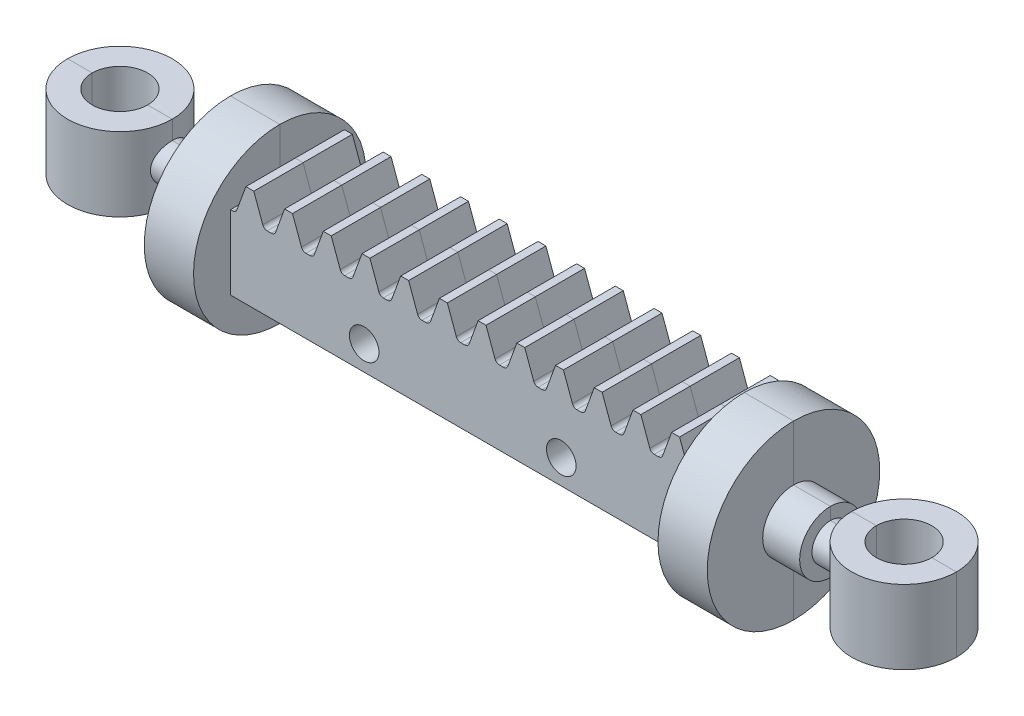
from build123d import *

# Parameters (mm, degrees)
SKETCH2_W                 = 37.699111843
SKETCH2_H                 = 6
BACK_DEPTH                = 8
TEETH_DEPTH               = 8
FILLET1_R                 = 0.38
LPATTERN1_COUNT           = 12
LPATTERN1_PITCH           = 3.141592654
FILLET1_OF_LPATTERN1_R    = 0.38
BOSS_EXTRUDE10_DEPTH      = 3
BOSS_EXTRUDE10_DEPTH_BACK = 3
SKETCH6_7_R               = 4.25
SKETCH6_7_R_2             = 2.25
SKETCH8_R                 = 2
SKETCH8_R_2               = 1.6
SKETCH8_R_3               = 1.2
BOSS_EXTRUDE11_DEPTH      = 8
SKETCH8_3_R               = 1.2
CUT_EXTRUDE1_DEPTH        = 57.901863991


with BuildPart() as part:
    # Sketch2 → Back (new body)
    with BuildSketch(Plane.XY):
        with Locations((18.849555922, -3)):
            Rectangle(SKETCH2_W, SKETCH2_H)
    extrude(amount=-BACK_DEPTH)

    # Sketch2<3> → Teeth (add)
    with BuildSketch(Plane.XY):
        Polygon((1.249368398, 2.25), (0.430435371, 0), (2.711157283, 0), (1.892224256, 2.25), align=None)
    teeth = extrude(amount=-TEETH_DEPTH)

    # Fillet1
    fillet1_edges = [part.edges().sort_by_distance(p)[0] for p in [
        (2.711157283, 0, -4),
        (0.430435371, 0, -4),
    ]]
    fillet(fillet1_edges, radius=FILLET1_R)

    # LPattern1: Teeth ×12
    with Locations(*[(i * LPATTERN1_PITCH, 0, 0) for i in range(1, LPATTERN1_COUNT)]):
        add(teeth)

    # Fillet1 of LPattern1
    fillet1_of_lpattern1_edges = [part.edges().sort_by_distance(p)[0] for p in [
        (5.852749937, 0, -4),
        (3.572028024, 0, -4),
        (8.99434259, 0, -4),
        (6.713620678, 0, -4),
        (12.135935244, 0, -4),
        (9.855213331, 0, -4),
        (15.277527897, 0, -4),
        (12.996805985, 0, -4),
        (18.419120551, 0, -4),
        (16.138398639, 0, -4),
        (21.560713205, 0, -4),
        (19.279991292, 0, -4),
        (24.702305858, 0, -4),
        (22.421583946, 0, -4),
        (27.843898512, 0, -4),
        (25.563176599, 0, -4),
        (30.985491165, 0, -4),
        (28.704769253, 0, -4),
        (34.127083819, 0, -4),
        (31.846361906, 0, -4),
        (37.268676473, 0, -4),
        (34.98795456, 0, -4),
    ]]
    fillet(fillet1_of_lpattern1_edges, radius=FILLET1_OF_LPATTERN1_R)

    # Sketch6 → Revolve1 (revolve)
    with BuildSketch(Plane(origin=(0, -3, 0), x_dir=(1, 0, 0), z_dir=(0, 1, 0)), mode=Mode.PRIVATE) as revolve1_sk:
        with BuildLine():
            Line((0, -3), (0, 4))
            Line((0, 4), (-8.72649343, 4))
            ThreePointArc((-8.72649343, 4), (-8.795429147, 3.2376343), (-9, 2.5))
            Line((-9, 2.5), (-7, 2.5))
            Line((-7, 2.5), (-7, 1.5))
            Line((-7, 1.5), (-4, 1.5))
            Line((-4, 1.5), (-4, -3))
            Line((-4, -3), (0, -3))
        make_face()
    revolve1 = revolve(revolve1_sk.sketch.rotate(Axis((0, -3, -4), (-1, 0, 0)), 180), axis=Axis((0, -3, -4), (-1, 0, 0)))

    # Sketch6<7> → Boss-Extrude10 (add, two sides: drawn at the far end of the back side and taken through both)
    # profile 1 of 2: a face of its own
    with BuildSketch(Plane(origin=(0, -3, 0), x_dir=(1, 0, 0), z_dir=(0, 1, 0)).offset(-BOSS_EXTRUDE10_DEPTH_BACK)):
        with Locations((-12.97649343, 4)):
            Circle(SKETCH6_7_R)
        with Locations((-12.97649343, 4)):
            Circle(SKETCH6_7_R_2, mode=Mode.SUBTRACT)
    # profile 2 of 2: a face of its own
    with BuildSketch(Plane(origin=(0, -3, 0), x_dir=(1, 0, 0), z_dir=(0, 1, 0)).offset(-BOSS_EXTRUDE10_DEPTH_BACK)):
        with Locations((50.675605273, 4)):
            Circle(SKETCH6_7_R)
        with Locations((50.675605273, 4)):
            Circle(SKETCH6_7_R_2, mode=Mode.SUBTRACT)
    extrude(amount=BOSS_EXTRUDE10_DEPTH + BOSS_EXTRUDE10_DEPTH_BACK)


with BuildPart() as boss_extrude10_piece_1:
    # of the separate pieces the step leaves, piece 1, a body of its own (boss_extrude10_pieces)
    add(part.part.solids().sort_by_distance((0, -3, -11))[0])



with BuildPart() as boss_extrude10_piece_2:
    # of the separate pieces the step leaves, piece 2, a body of its own (boss_extrude10_pieces)
    add(part.part.solids().sort_by_distance((54.925605273, -3, -4))[0])


with BuildPart() as boss_extrude10_piece_1_1:
    add(boss_extrude10_piece_1.part)

    add(boss_extrude10_piece_2.part)  # Mirror1 merges Boss-Extrude10 piece 2
    # Mirror1: Revolve1 across plane
    add(revolve1.mirror(Plane.ZY.offset(-18.849555922)))

    # Sketch8 → Boss-Extrude11 (add)
    # profile 1 of 2: a face of its own
    with BuildSketch(Plane.XY):
        with Locations((10.849555922, -4)):
            Circle(SKETCH8_R)
        with Locations((10.849555922, -4)):
            Circle(SKETCH8_R_2, mode=Mode.SUBTRACT)
    # profile 2 of 2: a face of its own
    with BuildSketch(Plane.XY):
        with Locations((10.849555922, -4)):
            Circle(SKETCH8_R_2)
        with Locations((10.849555922, -4)):
            Circle(SKETCH8_R_3, mode=Mode.SUBTRACT)
    boss_extrude11 = extrude(amount=-BOSS_EXTRUDE11_DEPTH)

    # Sketch8<3> → Cut-Extrude1 (cut, through all)
    with BuildSketch(Plane.XY):
        with Locations((10.849555922, -4)):
            Circle(SKETCH8_3_R)
    cut_extrude1 = extrude(amount=-CUT_EXTRUDE1_DEPTH, mode=Mode.SUBTRACT)

    # Mirror2: Boss-Extrude11, Cut-Extrude1 across plane
    add(boss_extrude11.mirror(Plane.ZY.offset(-18.849555922)))
    add(cut_extrude1.mirror(Plane.ZY.offset(-18.849555922)), mode=Mode.SUBTRACT)


with BuildPart() as body_2:
    # Split1: the piece on the far side of the plane
    add(boss_extrude10_piece_1_1.part)
    split(bisect_by=Plane.XY.offset(-4), keep=Keep.BOTTOM)


with BuildPart() as boss_extrude10_piece_1_2:
    add(boss_extrude10_piece_1_1.part)

    # Split1
    split(bisect_by=Plane.XY.offset(-4), keep=Keep.TOP)


solid = Compound([body_2.part, boss_extrude10_piece_1_2.part])
